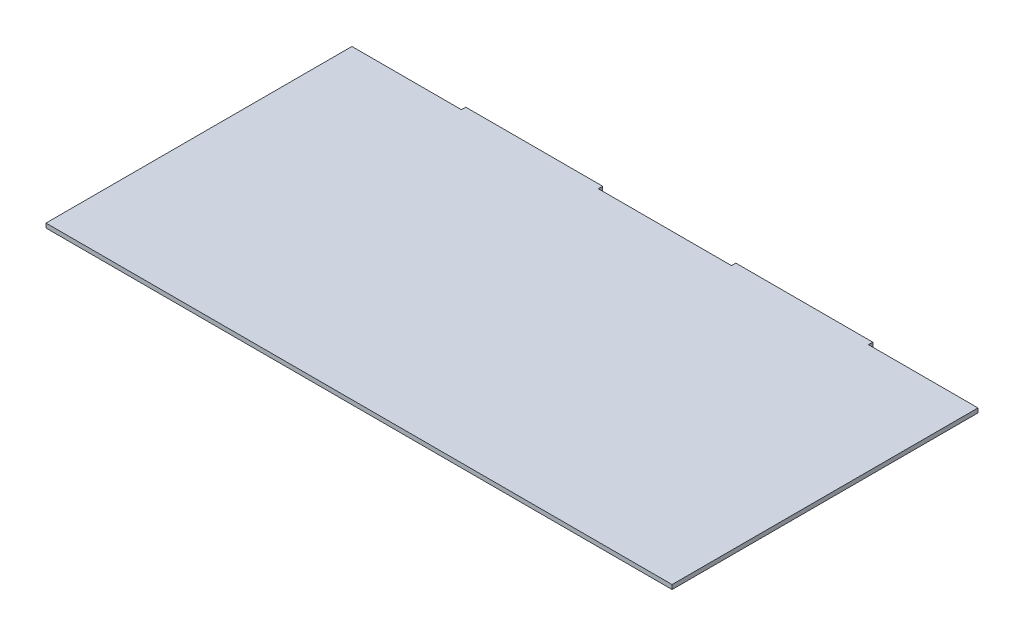
from build123d import *

# Parameters (mm, degrees)
SKETCH1_W           = 457.2
SKETCH1_H           = 3.175
BOSS_EXTRUDE1_DEPTH = 223.380000026
SKETCH2_W           = 100
SKETCH2_H           = 3.175
BOSS_EXTRUDE2_DEPTH = 3.175


with BuildPart() as part:
    # Sketch1 → Boss-Extrude1 (new body)
    with BuildSketch(Plane.XY):
        Rectangle(SKETCH1_W, SKETCH1_H)
    extrude(amount=BOSS_EXTRUDE1_DEPTH)

    # Sketch2 → Boss-Extrude2 (add)
    with BuildSketch(Plane(origin=(0, 0, 0), x_dir=(-1, 0, 0), z_dir=(0, 0, -1))):
        with Locations((-98.6, 0)):
            Rectangle(SKETCH2_W, SKETCH2_H)
        with Locations((98.623, 0)):
            Rectangle(SKETCH2_W, SKETCH2_H)
    extrude(amount=BOSS_EXTRUDE2_DEPTH)


solid = part.part
